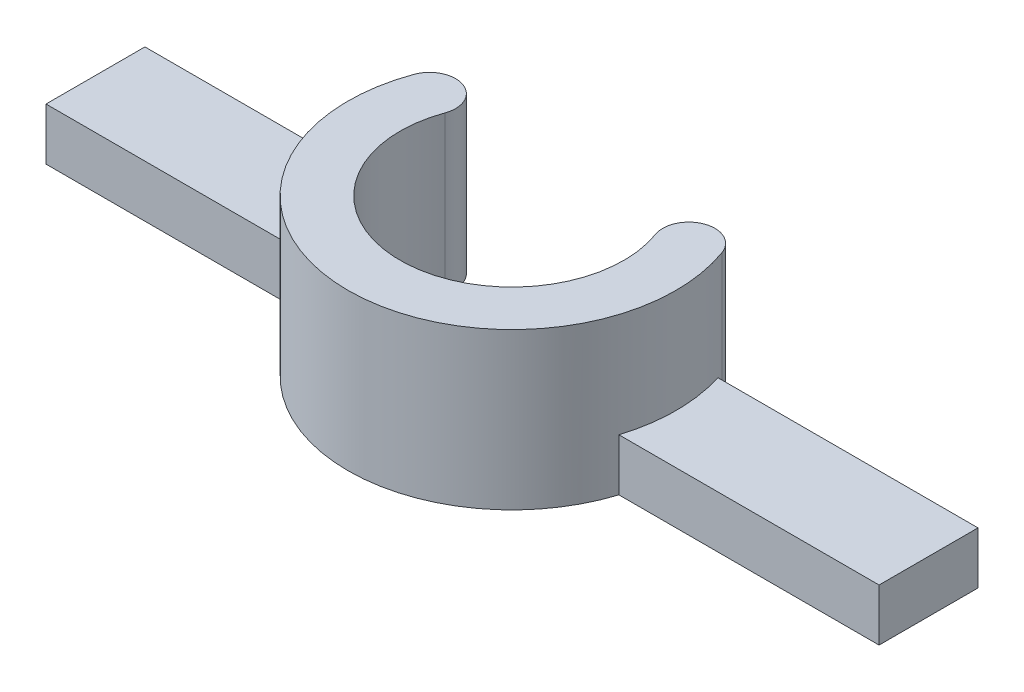
from build123d import *

# Parameters (mm, degrees)
BOSS_EXTRUDE1_DEPTH = 6
SKETCH2_W           = 11.5
SKETCH2_H           = 3.8
SKETCH2_H_2         = 1.9
BOSS_EXTRUDE2_DEPTH = 2


with BuildPart() as part:
    # Sketch1 → Boss-Extrude1 (new body)
    with BuildSketch(Plane(origin=(0, 0, 0), x_dir=(1, 0, 0), z_dir=(0, 1, 0))):
        with BuildLine():
            Line((6.3, 0), (4.3, 0))
            ThreePointArc((4.3, 0), (-0.746687164, -4.234673338), (-4.040678269, 1.470686616))
            ThreePointArc((-4.040678269, 1.470686616), (-4.638350747, 2.75239938), (-5.920063511, 2.154726903))
            ThreePointArc((-5.920063511, 2.154726903), (-1.093983519, -6.204288844), (6.3, 0))
        make_face()
        with BuildLine():
            ThreePointArc((4.040678269, 1.470686616), (4.234673338, 0.746687164), (4.3, 0))
            Line((4.3, 0), (6.3, 0))
            ThreePointArc((6.3, 0), (6.204288844, 1.093983519), (5.920063511, 2.154726903))
            Line((5.920063511, 2.154726903), (4.98037089, 1.81270676))
            Line((4.98037089, 1.81270676), (4.040678269, 1.470686616))
        make_face()
        with BuildLine():
            ThreePointArc((5.920063511, 2.154726903), (4.638350747, 2.75239938), (4.040678269, 1.470686616))
            Line((4.040678269, 1.470686616), (4.98037089, 1.81270676))
            Line((4.98037089, 1.81270676), (5.920063511, 2.154726903))
        make_face()
    extrude(amount=BOSS_EXTRUDE1_DEPTH)

    # Sketch2 → Boss-Extrude2 (add)
    with BuildSketch(Plane(origin=(0, 0, 0), x_dir=(1, 0, 0), z_dir=(0, 1, 0))):
        with Locations((-10.25, 0)):
            Rectangle(SKETCH2_W, SKETCH2_H)
        with Locations((10.25, -0.95)):
            Rectangle(SKETCH2_W, SKETCH2_H_2)
        with Locations((10.25, 0.95)):
            Rectangle(SKETCH2_W, SKETCH2_H_2)
    extrude(amount=BOSS_EXTRUDE2_DEPTH)


solid = part.part
